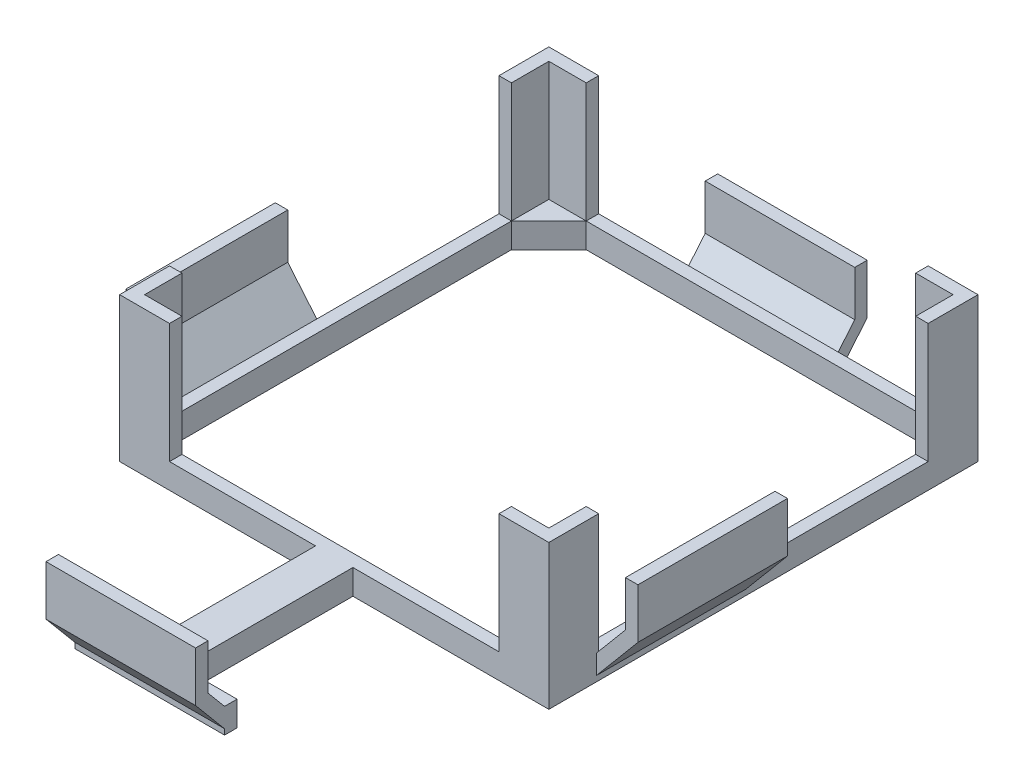
from build123d import *

# Parameters (mm, degrees)
SKETCH1_W                                    = 172.2
SKETCH1_H                                    = 172.2
SKETCH1_W_2                                  = 162.2
SKETCH1_H_2                                  = 162.2
BASE_DEPTH                                   = 10
LEDGES_SIZE                                  = 15
POST_DEPTH                                   = 48
MIRRORED_POSTS_AT_THE_SECOND_PLANE_C_2_DEPTH = 48
SIDE_ARM_DEPTH                               = 30
TOP_BOTTOM_ARMS_DEPTH                        = 30
SKETCH9_W                                    = 22.5
SKETCH9_H                                    = 69
BOTTOM_ARM_CUTOUT_DEPTH                      = 177.122471593


with BuildPart() as part:
    # Sketch1 → base (new body)
    with BuildSketch(Plane(origin=(0, 0, 0), x_dir=(1, 0, 0), z_dir=(0, 1, 0))):
        with Locations((0, 37)):
            Rectangle(SKETCH1_W, SKETCH1_H)
        with Locations((0, 37)):
            Rectangle(SKETCH1_W_2, SKETCH1_H_2, mode=Mode.SUBTRACT)
    extrude(amount=-BASE_DEPTH)

    # ledges
    ledges_edges = [part.edges().sort_by_distance(p)[0] for p in [
        (-81.1, -5, 44.1),
        (-81.1, -5, -118.1),
        (81.1, -5, -118.1),
        (81.1, -5, 44.1),
    ]]
    chamfer(ledges_edges, length=LEDGES_SIZE)

    # Sketch2 → post (add)
    with BuildSketch(Plane(origin=(0, 0, 0), x_dir=(1, 0, 0), z_dir=(0, 1, 0))):
        Polygon((-81.1, 103.1), (-86.1, 103.1), (-86.1, 123.1), (-66.1, 123.1), (-66.1, 118.1), (-81.1, 118.1), align=None)
    post = extrude(amount=POST_DEPTH)

    # mirrored-posts: post across plane
    add(post.mirror(Plane.XY.offset(-37)))

    # mirrored-posts at the second plane: post across plane
    add(post.mirror(Plane(origin=(0, 0, 0), x_dir=(0, 0, 1), z_dir=(1, 0, 0))))

    # mirrored-posts at the second plane copy → mirrored-posts at the second plane c 2 (add)
    with BuildSketch(Plane(origin=(0, 0, -74), x_dir=(-1, 0, 0), z_dir=(0, 1, 0))):
        Polygon((-81.1, 103.1), (-86.1, 103.1), (-86.1, 123.1), (-66.1, 123.1), (-66.1, 118.1), (-81.1, 118.1), align=None)
    extrude(amount=MIRRORED_POSTS_AT_THE_SECOND_PLANE_C_2_DEPTH)

    # Sketch7 → side-arm (add, symmetric)
    with BuildSketch(Plane.XY):
        Polygon((86.1, -7.778619134), (102.75, 12.064078182), (102.75, 32.064078182), (97.75, 32.064078182), (97.75, 13.883929354), (86.1, 0), align=None)
    side_arm = extrude(amount=SIDE_ARM_DEPTH, both=True)

    # side-arm-mirrored: side-arm across plane
    add(side_arm.mirror(Plane(origin=(0, 0, 0), x_dir=(0, 0, 1), z_dir=(1, 0, 0))))

    # Sketch8 → top-bottom-arms (add, symmetric)
    with BuildSketch(Plane(origin=(0, 0, 0), x_dir=(0, 0, -1), z_dir=(1, 0, 0))):
        Polygon((123.1, -7.778619134), (134.75, 6.105310219), (134.75, 26.105310219), (129.75, 26.105310219), (129.75, 7.925161391), (123.1, 0), align=None)
        Polygon((-49.1, -10), (-123.1, -10), (-123.1, -7.778619134), (-134.75, 6.105310219), (-134.75, 26.105310219), (-129.75, 26.105310219), (-129.75, 7.925161391), (-123.1, 0), (-49.1, 0), align=None)
    extrude(amount=TOP_BOTTOM_ARMS_DEPTH, both=True)

    # Sketch9 → bottom-arm-cutout (cut, through all)
    with BuildSketch(Plane(origin=(0, 0, 0), x_dir=(1, 0, 0), z_dir=(0, 1, 0))):
        with Locations((-18.75, -83.6)):
            Rectangle(SKETCH9_W, SKETCH9_H)
        with Locations((18.75, -83.6)):
            Rectangle(SKETCH9_W, SKETCH9_H)
    extrude(amount=-BOTTOM_ARM_CUTOUT_DEPTH, mode=Mode.SUBTRACT)


solid = part.part
